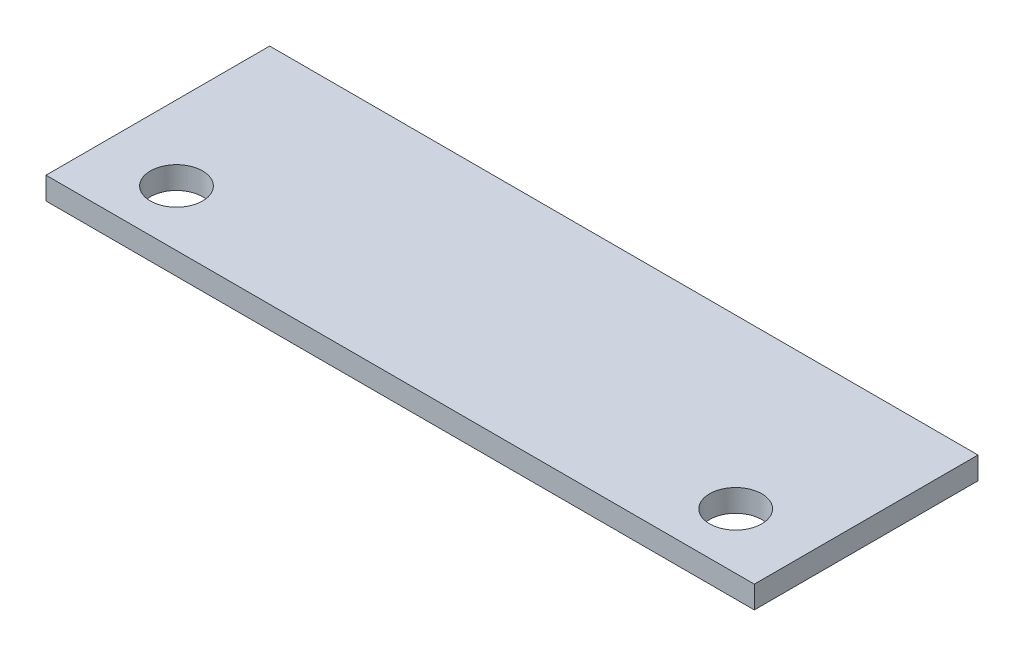
from build123d import *

# Parameters (mm, degrees)
SKETCH1_W               = 190
SKETCH1_H               = 60
BOSS_EXTRUDE1_DEPTH     = 6
CUT_EXTRUDE1_DEPTH      = 100.804809503
CUT_EXTRUDE1_DEPTH_BACK = 100.804809503
SKETCH2_R               = 7


with BuildPart() as part:
    # Sketch1 → Boss-Extrude1 (new body)
    with BuildSketch(Plane(origin=(0, 0, 0), x_dir=(1, 0, 0), z_dir=(0, 1, 0))):
        Rectangle(SKETCH1_W, SKETCH1_H)
    extrude(amount=BOSS_EXTRUDE1_DEPTH)

    # Sketch2 → Cut-Extrude1 (cut, two sides: drawn at the far end of the back side and taken through both)
    with BuildSketch(Plane(origin=(0, 6, 0), x_dir=(1, 0, 0), z_dir=(0, 1, 0)).offset(-CUT_EXTRUDE1_DEPTH_BACK)):
        with Locations(Location((75, -15, 0), (0, 0, 270))):
            Circle(SKETCH2_R)
        with Locations(Location((-75, -15, 0), (0, 0, 270))):
            Circle(SKETCH2_R)
    extrude(amount=CUT_EXTRUDE1_DEPTH + CUT_EXTRUDE1_DEPTH_BACK, mode=Mode.SUBTRACT)


solid = part.part
